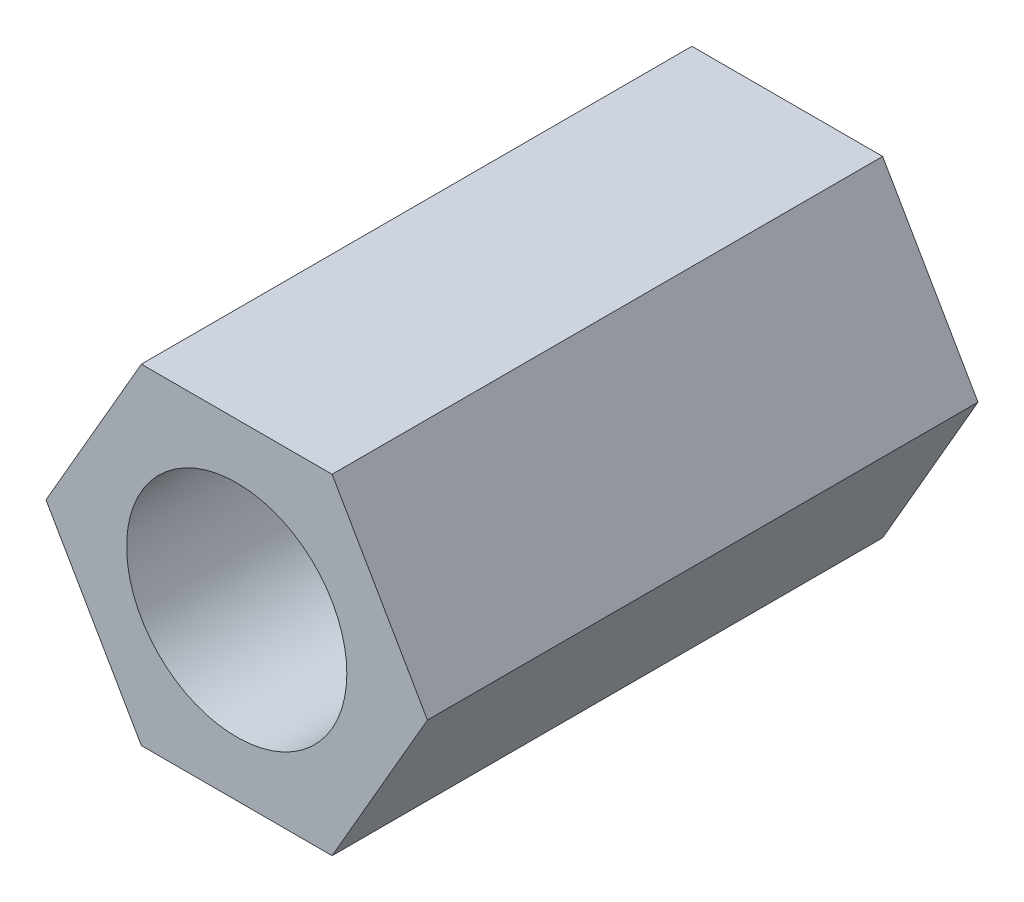
from build123d import *

# Parameters (mm, degrees)
SKETCH_1_R      = 1
EXTRUDE_1_DEPTH = 5


with BuildPart() as part:
    # 草图1 → 凸台-拉伸1 (new body)
    with BuildSketch(Plane.XY):
        Polygon((1.732050808, 0), (0.866025404, 1.5), (-0.866025404, 1.5), (-1.732050808, 0), (-0.866025404, -1.5), (0.866025404, -1.5), align=None)
        Circle(SKETCH_1_R, mode=Mode.SUBTRACT)
    extrude(amount=EXTRUDE_1_DEPTH)


solid = part.part
